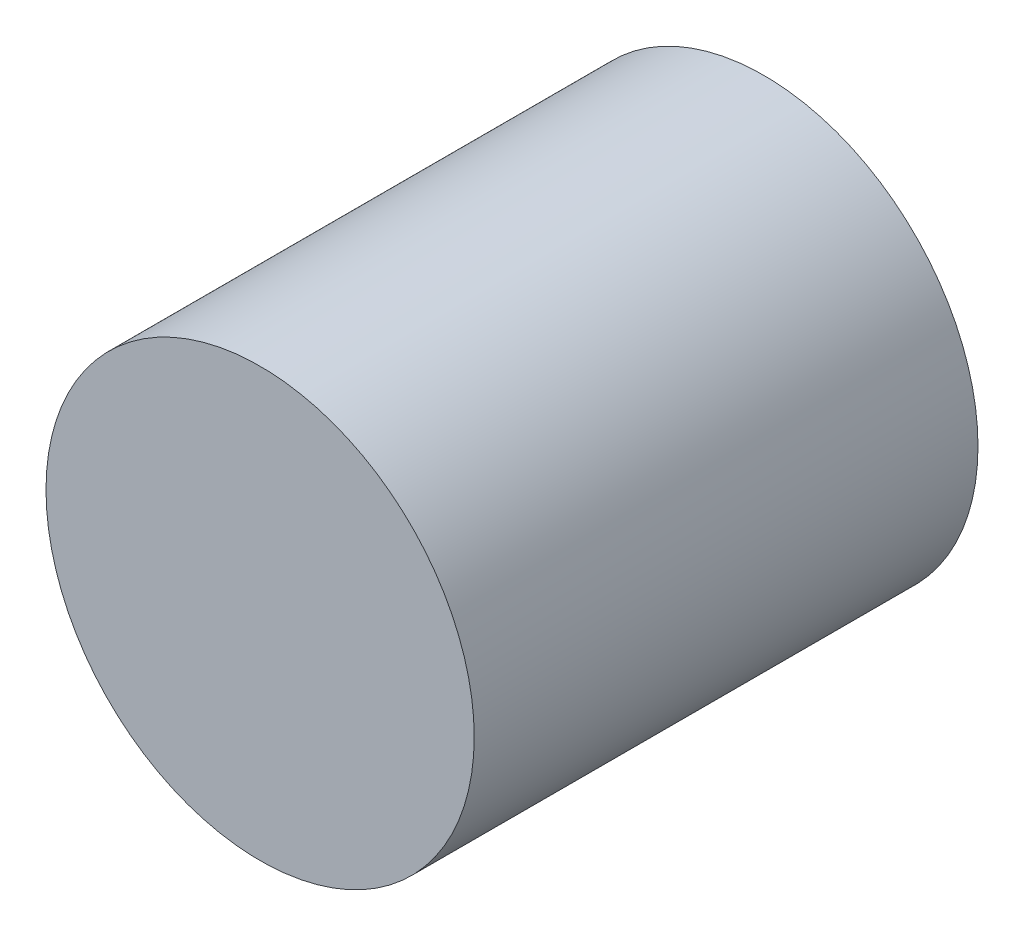
from build123d import *

# Parameters (mm, degrees)
EXTRUDE_1_DEPTH     = 12
SKETCH_2_OUTSIDE_W  = 117.568
SKETCH_2_OUTSIDE_H  = 117.568
SKETCH_2_OUTSIDE_R  = 5.1
CUT_EXTRUDE_1_DEPTH = 102.336074524


with BuildPart() as part:
    # 草图1 → 凸台-拉伸1 (new body)
    with BuildSketch(Plane.XY):
        Polygon((-45, 0), (45, 0), (45, 15), (10, 15), (10, 90), (-10, 90), (-10, 15), (-45, 15), align=None)
    extrude(amount=EXTRUDE_1_DEPTH)

    # 草图2 outside → 切除-拉伸1 (cut, through all)
    with BuildSketch(Plane.XY.offset(12)):
        with Locations((0, 45)):
            Rectangle(SKETCH_2_OUTSIDE_W, SKETCH_2_OUTSIDE_H)
        with Locations((0, 65)):
            Circle(SKETCH_2_OUTSIDE_R, mode=Mode.SUBTRACT)
    extrude(amount=-CUT_EXTRUDE_1_DEPTH, mode=Mode.SUBTRACT)


solid = part.part
